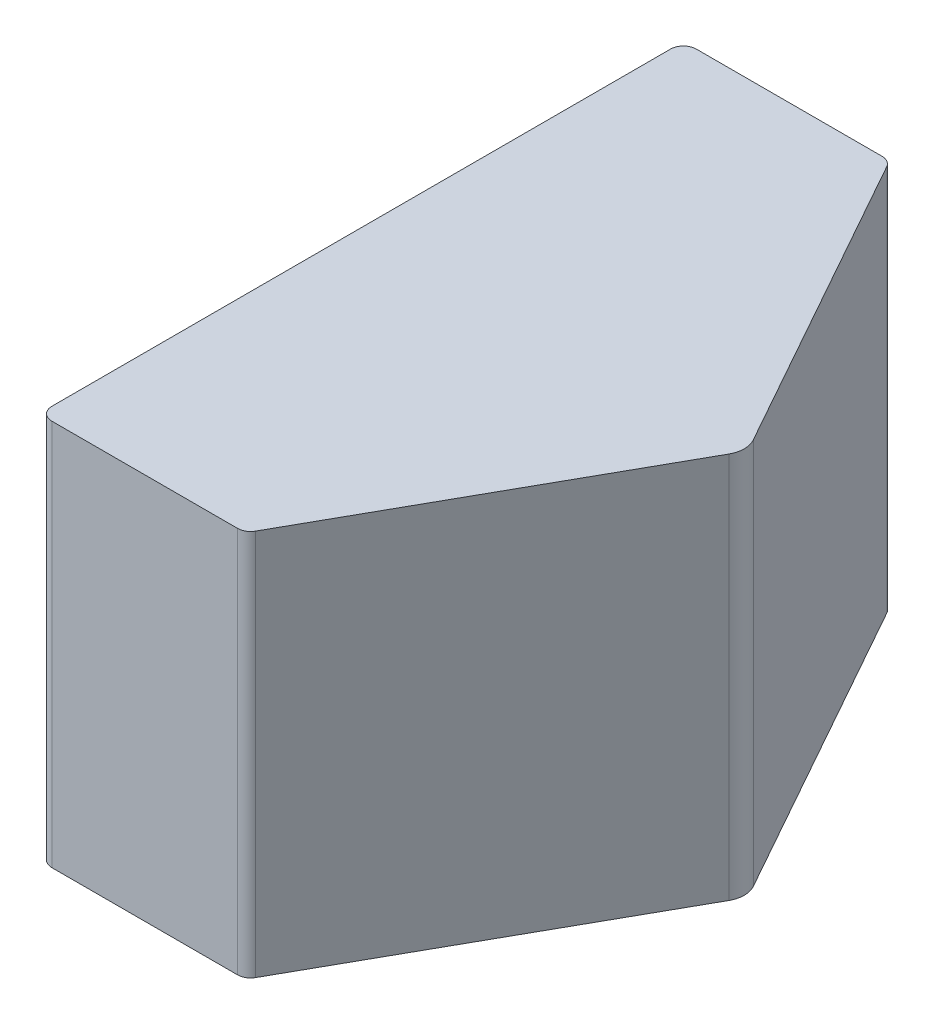
from build123d import *

# Parameters (mm, degrees)
EXTRUDE_1_DEPTH     = 150
SKETCH_2_W          = 80
SKETCH_2_H          = 80
CUT_EXTRUDE_1_DEPTH = 100


with BuildPart() as part:
    # 草图1 → 凸台-拉伸1 (new body)
    with BuildSketch(Plane(origin=(0, 0, 0), x_dir=(1, 0, 0), z_dir=(0, 1, 0))):
        with BuildLine():
            Line((0, -5), (0, -245))
            ThreePointArc((0, -245), (1.464466094, -248.535533906), (5, -250))
            Line((5, -250), (77.069380487, -250))
            ThreePointArc((77.069380487, -250), (79.597711535, -249.313646035), (81.431910567, -247.443016845))
            Line((81.431910567, -247.443016845), (147.351808168, -129.728913986))
            ThreePointArc((147.351808168, -129.728913986), (148.585749894, -125), (147.351808168, -120.271086014))
            Line((147.351808168, -120.271086014), (81.431910567, -2.556983155))
            ThreePointArc((81.431910567, -2.556983155), (79.597711535, -0.686353965), (77.069380487, 0))
            Line((77.069380487, 0), (5, 0))
            ThreePointArc((5, 0), (1.464466094, -1.464466094), (0, -5))
        make_face()
    extrude(amount=EXTRUDE_1_DEPTH)

    # 草图2 → 切除-拉伸1 (cut)
    with BuildSketch(Plane.ZY):
        with Locations((125, 40)):
            Rectangle(SKETCH_2_W, SKETCH_2_H)
    extrude(amount=-CUT_EXTRUDE_1_DEPTH, mode=Mode.SUBTRACT)


solid = part.part
